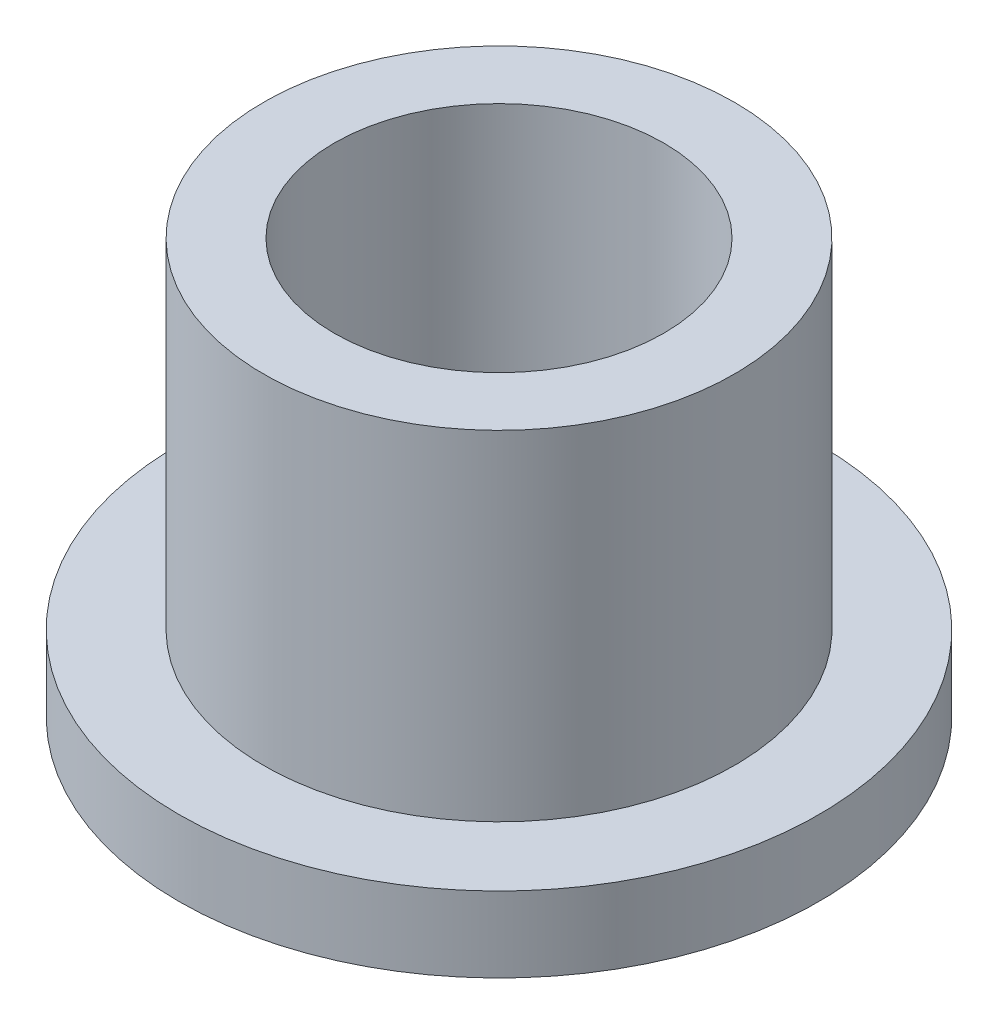
from build123d import *

# Parameters (mm, degrees)
SKETCH2_R          = 17.5
CUT_EXTRUDE1_DEPTH = 50


with BuildPart() as part:
    # Sketch1 → Revolve1 (revolve)
    with BuildSketch(Plane.XY, mode=Mode.PRIVATE) as revolve1_sk:
        Polygon((0, 0), (34, 0), (34, 8), (25, 8), (25, 44), (17.5, 44), (0, 44), align=None)
    revolve(revolve1_sk.sketch.rotate(Axis((0, 0, 0), (0, 1, 0)), 90), axis=Axis((0, 0, 0), (0, 1, 0)))

    # Sketch2 → Cut-Extrude1 (cut)
    with BuildSketch(Plane(origin=(0, 44, 0), x_dir=(1, 0, 0), z_dir=(0, 1, 0))):
        with Locations(Location((0, 0, 0), (0, 0, 270))):
            Circle(SKETCH2_R)
    extrude(amount=-CUT_EXTRUDE1_DEPTH, mode=Mode.SUBTRACT)


solid = part.part
